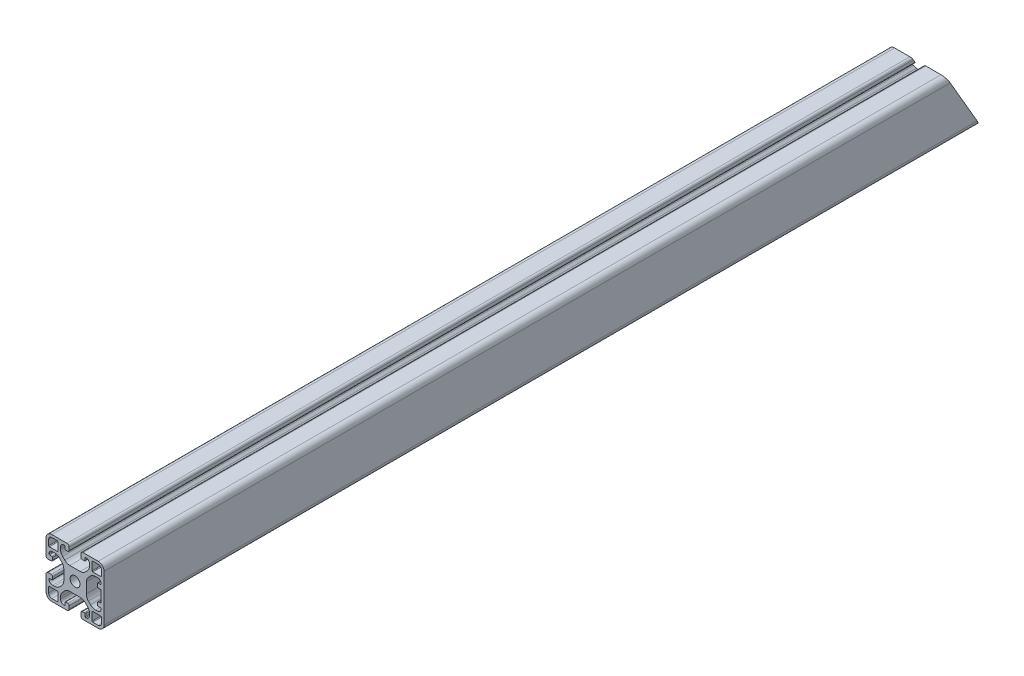
from build123d import *

# Parameters (mm, degrees)
SCHIZZO1_R                   = 3.4
ESTRUSIONE_ESTRUSIONE1_DEPTH = 604
TAGLIO_ESTRUSIONE1_DEPTH     = 343.92856399


with BuildPart() as part:
    # Schizzo1 → Estrusione-Estrusione1 (new body)
    with BuildSketch(Plane(origin=(0, 0, -340), x_dir=(-1, 0, 0), z_dir=(0, 0, -1))):
        with BuildLine():
            Line((6.5, -15.5), (5, -15.5))
            ThreePointArc((5, -15.5), (4.292893219, -15.792893219), (4, -16.5))
            Line((4, -16.5), (4, -18.5))
            ThreePointArc((4, -18.5), (4.439339828, -19.560660172), (5.5, -20))
            Line((5.5, -20), (16, -20))
            ThreePointArc((16, -20), (18.828427125, -18.828427125), (20, -16))
            Line((20, -16), (20, -5.5))
            ThreePointArc((20, -5.5), (19.560660172, -4.439339828), (18.5, -4))
            Line((18.5, -4), (16.5, -4))
            ThreePointArc((16.5, -4), (15.792893219, -4.292893219), (15.5, -5))
            Line((15.5, -5), (15.5, -6.5))
            ThreePointArc((15.5, -6.5), (15.646446609, -6.853553391), (16, -7))
            Line((16, -7), (17.55, -7))
            ThreePointArc((17.55, -7), (17.868198052, -7.131801948), (18, -7.45))
            Line((18, -7.45), (18, -7.5))
            ThreePointArc((18, -7.5), (17.267766953, -9.267766953), (15.5, -10))
            Line((15.5, -10), (14.192388155, -10))
            ThreePointArc((14.192388155, -10), (12.278970994, -9.619397663), (10.656854249, -8.535533906))
            Line((10.656854249, -8.535533906), (9.214466094, -7.09314575))
            ThreePointArc((9.214466094, -7.09314575), (8.130602337, -5.471029006), (7.75, -3.557611845))
            Line((7.75, -3.557611845), (7.75, 3.557611845))
            ThreePointArc((7.75, 3.557611845), (8.130602337, 5.471029006), (9.214466094, 7.09314575))
            Line((9.214466094, 7.09314575), (10.656854249, 8.535533906))
            ThreePointArc((10.656854249, 8.535533906), (12.278970994, 9.619397663), (14.192388155, 10))
            Line((14.192388155, 10), (15.5, 10))
            ThreePointArc((15.5, 10), (17.267766953, 9.267766953), (18, 7.5))
            Line((18, 7.5), (18, 7.45))
            ThreePointArc((18, 7.45), (17.868198052, 7.131801948), (17.55, 7))
            Line((17.55, 7), (16, 7))
            ThreePointArc((16, 7), (15.646446609, 6.853553391), (15.5, 6.5))
            Line((15.5, 6.5), (15.5, 5))
            ThreePointArc((15.5, 5), (15.792893219, 4.292893219), (16.5, 4))
            Line((16.5, 4), (18.5, 4))
            ThreePointArc((18.5, 4), (19.560660172, 4.439339828), (20, 5.5))
            Line((20, 5.5), (20, 16))
            ThreePointArc((20, 16), (18.828427125, 18.828427125), (16, 20))
            Line((16, 20), (5.5, 20))
            ThreePointArc((5.5, 20), (4.439339828, 19.560660172), (4, 18.5))
            Line((4, 18.5), (4, 16.5))
            ThreePointArc((4, 16.5), (4.292893219, 15.792893219), (5, 15.5))
            Line((5, 15.5), (6.5, 15.5))
            ThreePointArc((6.5, 15.5), (6.853553391, 15.646446609), (7, 16))
            Line((7, 16), (7, 17.55))
            ThreePointArc((7, 17.55), (7.131801948, 17.868198052), (7.45, 18))
            Line((7.45, 18), (7.5, 18))
            ThreePointArc((7.5, 18), (9.267766953, 17.267766953), (10, 15.5))
            Line((10, 15.5), (10, 14.192388155))
            ThreePointArc((10, 14.192388155), (9.619397663, 12.278970994), (8.535533906, 10.656854249))
            Line((8.535533906, 10.656854249), (7.09314575, 9.214466094))
            ThreePointArc((7.09314575, 9.214466094), (5.471029006, 8.130602337), (3.557611844, 7.75))
            Line((3.557611844, 7.75), (-3.557611845, 7.75))
            ThreePointArc((-3.557611845, 7.75), (-5.471029006, 8.130602337), (-7.09314575, 9.214466094))
            Line((-7.09314575, 9.214466094), (-8.535533906, 10.656854249))
            ThreePointArc((-8.535533906, 10.656854249), (-9.619397663, 12.278970994), (-10, 14.192388155))
            Line((-10, 14.192388155), (-10, 15.5))
            ThreePointArc((-10, 15.5), (-9.267766953, 17.267766953), (-7.5, 18))
            Line((-7.5, 18), (-7.45, 18))
            ThreePointArc((-7.45, 18), (-7.131801948, 17.868198052), (-7, 17.55))
            Line((-7, 17.55), (-7, 16))
            ThreePointArc((-7, 16), (-6.853553391, 15.646446609), (-6.5, 15.5))
            Line((-6.5, 15.5), (-5, 15.5))
            ThreePointArc((-5, 15.5), (-4.292893219, 15.792893219), (-4, 16.5))
            Line((-4, 16.5), (-4, 18.5))
            ThreePointArc((-4, 18.5), (-4.439339828, 19.560660172), (-5.5, 20))
            Line((-5.5, 20), (-16, 20))
            ThreePointArc((-16, 20), (-18.828427125, 18.828427125), (-20, 16))
            Line((-20, 16), (-20, -16))
            ThreePointArc((-20, -16), (-18.828427125, -18.828427125), (-16, -20))
            Line((-16, -20), (-5.5, -20))
            ThreePointArc((-5.5, -20), (-4.439339828, -19.560660172), (-4, -18.5))
            Line((-4, -18.5), (-4, -16.5))
            ThreePointArc((-4, -16.5), (-4.292893219, -15.792893219), (-5, -15.5))
            Line((-5, -15.5), (-6.5, -15.5))
            ThreePointArc((-6.5, -15.5), (-6.853553391, -15.646446609), (-7, -16))
            Line((-7, -16), (-7, -17.55))
            ThreePointArc((-7, -17.55), (-7.131801948, -17.868198052), (-7.45, -18))
            Line((-7.45, -18), (-7.5, -18))
            ThreePointArc((-7.5, -18), (-9.267766953, -17.267766953), (-10, -15.5))
            Line((-10, -15.5), (-10, -14.192388155))
            ThreePointArc((-10, -14.192388155), (-9.619397663, -12.278970994), (-8.535533906, -10.656854249))
            Line((-8.535533906, -10.656854249), (-7.09314575, -9.214466094))
            ThreePointArc((-7.09314575, -9.214466094), (-5.471029006, -8.130602337), (-3.557611845, -7.75))
            Line((-3.557611845, -7.75), (3.557611845, -7.75))
            ThreePointArc((3.557611845, -7.75), (5.471029006, -8.130602337), (7.09314575, -9.214466094))
            Line((7.09314575, -9.214466094), (8.535533906, -10.656854249))
            ThreePointArc((8.535533906, -10.656854249), (9.619397663, -12.278970994), (10, -14.192388155))
            Line((10, -14.192388155), (10, -15.5))
            ThreePointArc((10, -15.5), (9.267766953, -17.267766953), (7.5, -18))
            Line((7.5, -18), (7.45, -18))
            ThreePointArc((7.45, -18), (7.131801948, -17.868198052), (7, -17.55))
            Line((7, -17.55), (7, -16))
            ThreePointArc((7, -16), (6.853553391, -15.646446609), (6.5, -15.5))
        make_face()
        with Locations(Location((0, 0, 0), (0, 0, 180))):
            Circle(SCHIZZO1_R, mode=Mode.SUBTRACT)
        with BuildLine():
            Line((-12.3, -18.2), (-16, -18.2))
            ThreePointArc((-16, -18.2), (-17.555634919, -17.555634919), (-18.2, -16))
            Line((-18.2, -16), (-18.2, -12.3))
            ThreePointArc((-18.2, -12.3), (-18.053553391, -11.946446609), (-17.7, -11.8))
            Line((-17.7, -11.8), (-12.3, -11.8))
            ThreePointArc((-12.3, -11.8), (-11.946446609, -11.946446609), (-11.8, -12.3))
            Line((-11.8, -12.3), (-11.8, -17.7))
            ThreePointArc((-11.8, -17.7), (-11.946446609, -18.053553391), (-12.3, -18.2))
        make_face(mode=Mode.SUBTRACT)
        with BuildLine():
            Line((-11.8, 17.7), (-11.8, 12.3))
            ThreePointArc((-11.8, 12.3), (-11.946446609, 11.946446609), (-12.3, 11.8))
            Line((-12.3, 11.8), (-17.7, 11.8))
            ThreePointArc((-17.7, 11.8), (-18.053553391, 11.946446609), (-18.2, 12.3))
            Line((-18.2, 12.3), (-18.2, 16))
            ThreePointArc((-18.2, 16), (-17.555634919, 17.555634919), (-16, 18.2))
            Line((-16, 18.2), (-12.3, 18.2))
            ThreePointArc((-12.3, 18.2), (-11.946446609, 18.053553391), (-11.8, 17.7))
        make_face(mode=Mode.SUBTRACT)
        with BuildLine():
            Line((18.2, 16), (18.2, 12.3))
            ThreePointArc((18.2, 12.3), (18.053553391, 11.946446609), (17.7, 11.8))
            Line((17.7, 11.8), (12.3, 11.8))
            ThreePointArc((12.3, 11.8), (11.946446609, 11.946446609), (11.8, 12.3))
            Line((11.8, 12.3), (11.8, 17.7))
            ThreePointArc((11.8, 17.7), (11.946446609, 18.053553391), (12.3, 18.2))
            Line((12.3, 18.2), (16, 18.2))
            ThreePointArc((16, 18.2), (17.555634919, 17.555634919), (18.2, 16))
        make_face(mode=Mode.SUBTRACT)
        with BuildLine():
            Line((18.2, -12.3), (18.2, -16))
            ThreePointArc((18.2, -16), (17.555634919, -17.555634919), (16, -18.2))
            Line((16, -18.2), (12.3, -18.2))
            ThreePointArc((12.3, -18.2), (11.946446609, -18.053553391), (11.8, -17.7))
            Line((11.8, -17.7), (11.8, -12.3))
            ThreePointArc((11.8, -12.3), (11.946446609, -11.946446609), (12.3, -11.8))
            Line((12.3, -11.8), (17.7, -11.8))
            ThreePointArc((17.7, -11.8), (18.053553391, -11.946446609), (18.2, -12.3))
        make_face(mode=Mode.SUBTRACT)
        with BuildLine():
            Line((-16, 7), (-17.5, 7))
            ThreePointArc((-17.5, 7), (-17.853553391, 7.146446609), (-18, 7.5))
            ThreePointArc((-18, 7.5), (-17.267766953, 9.267766953), (-15.5, 10))
            Line((-15.5, 10), (-14.192388155, 10))
            ThreePointArc((-14.192388155, 10), (-12.278970994, 9.619397663), (-10.656854249, 8.535533906))
            Line((-10.656854249, 8.535533906), (-9.214466094, 7.093145751))
            ThreePointArc((-9.214466094, 7.093145751), (-8.130602337, 5.471029006), (-7.75, 3.557611845))
            Line((-7.75, 3.557611845), (-7.75, -3.557611845))
            ThreePointArc((-7.75, -3.557611845), (-8.130602337, -5.471029006), (-9.214466094, -7.093145751))
            Line((-9.214466094, -7.093145751), (-10.656854249, -8.535533906))
            ThreePointArc((-10.656854249, -8.535533906), (-12.278970994, -9.619397663), (-14.192388155, -10))
            Line((-14.192388155, -10), (-15.5, -10))
            ThreePointArc((-15.5, -10), (-17.267766953, -9.267766953), (-18, -7.5))
            ThreePointArc((-18, -7.5), (-17.853553391, -7.146446609), (-17.5, -7))
            Line((-17.5, -7), (-16, -7))
            ThreePointArc((-16, -7), (-15.646446609, -6.853553391), (-15.5, -6.5))
            Line((-15.5, -6.5), (-15.5, -5))
            ThreePointArc((-15.5, -5), (-15.792893219, -4.292893219), (-16.5, -4))
            Line((-16.5, -4), (-17.5, -4))
            ThreePointArc((-17.5, -4), (-17.853553391, -3.853553391), (-18, -3.5))
            Line((-18, -3.5), (-18, 3.5))
            ThreePointArc((-18, 3.5), (-17.853553391, 3.853553391), (-17.5, 4))
            Line((-17.5, 4), (-16.5, 4))
            ThreePointArc((-16.5, 4), (-15.792893219, 4.292893219), (-15.5, 5))
            Line((-15.5, 5), (-15.5, 6.5))
            ThreePointArc((-15.5, 6.5), (-15.646446609, 6.853553391), (-16, 7))
        make_face(mode=Mode.SUBTRACT)
    extrude(amount=-ESTRUSIONE_ESTRUSIONE1_DEPTH)

    # Schizzo2 → Taglio-Estrusione1 (cut, through all)
    with BuildSketch(Plane(origin=(20, 0, 0), x_dir=(0, 0, -1), z_dir=(1, 0, 0))):
        Polygon((319.133132048, 16), (337.681459116, -16), (340, -16), (340, 16), align=None)
        Polygon((316.814591165, 20), (319.133132048, 16), (340, 16), (340, 20), align=None)
        Polygon((337.681459116, -16), (340, -20), (340, -16), align=None)
    extrude(amount=-TAGLIO_ESTRUSIONE1_DEPTH, mode=Mode.SUBTRACT)


solid = part.part
